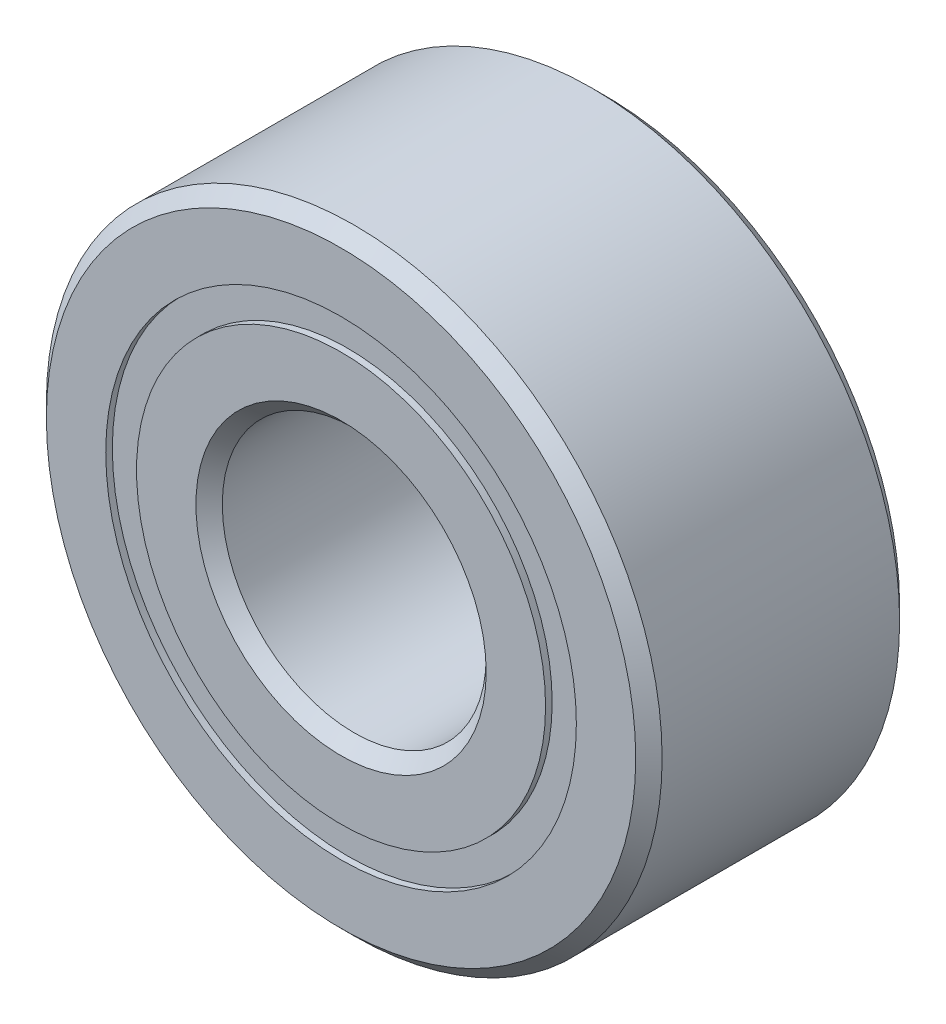
from build123d import *

# Parameters (mm, degrees)
CHAMFER1_SIZE = 0.15


with BuildPart() as part:
    # Sketch3 → Revolve1 (revolve)
    with BuildSketch(Plane(origin=(0, 0, 0), x_dir=(1, 0, 0), z_dir=(0, 1, 0))):
        Polygon((1.5, -1.5), (1.5, 1.5), (2.325, 1.5), (2.325, 1.425), (2.675, 1.425), (2.675, 1.5), (3.5, 1.5), (3.5, -1.5), (2.675, -1.5), (2.675, -1.425), (2.325, -1.425), (2.325, -1.5), align=None)
    revolve(axis=Axis((0, 0, 0), (0, 0, -1)))

    # Chamfer1
    chamfer1_edges = [part.edges().sort_by_distance(p)[0] for p in [
        (-3.5, 0, 1.5),
        (-3.5, 0, -1.5),
        (-1.5, 0, -1.5),
        (-1.5, 0, 1.5),
    ]]
    chamfer(chamfer1_edges, length=CHAMFER1_SIZE)


solid = part.part
